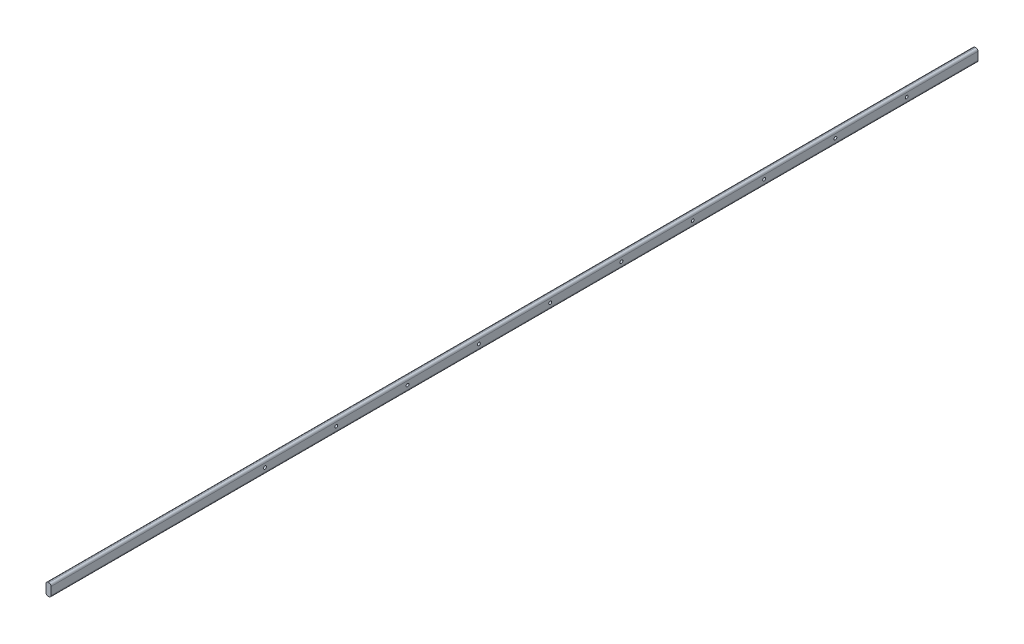
from build123d import *

# Parameters (mm, degrees)
EXTRUDE_1_DEPTH     = 1300
SKETCH_3_R          = 2
CUT_EXTRUDE_1_DEPTH = 1301.046633779


with BuildPart() as part:
    # 草图2 → 凸台-拉伸1 (new body)
    with BuildSketch(Plane.XY):
        with BuildLine():
            Line((-0.5, 8.5), (0.5, 8.5))
            ThreePointArc((0.5, 8.5), (2.621320344, 7.621320344), (3.5, 5.5))
            Line((3.5, 5.5), (3.5, -5.5))
            ThreePointArc((3.5, -5.5), (2.621320344, -7.621320344), (0.5, -8.5))
            Line((0.5, -8.5), (-0.5, -8.5))
            ThreePointArc((-0.5, -8.5), (-2.621320344, -7.621320344), (-3.5, -5.5))
            Line((-3.5, -5.5), (-3.5, 5.5))
            ThreePointArc((-3.5, 5.5), (-2.621320344, 7.621320344), (-0.5, 8.5))
        make_face()
    extrude(amount=EXTRUDE_1_DEPTH)

    # 草图3 → 切除-拉伸1 (cut, through all)
    with BuildSketch(Plane.ZY.offset(3.5)):
        with Locations((100, 0)):
            Circle(SKETCH_3_R)
        with Locations((200, 0)):
            Circle(SKETCH_3_R)
        with Locations((300, 0)):
            Circle(SKETCH_3_R)
        with Locations((400, 0)):
            Circle(SKETCH_3_R)
        with Locations((500, 0)):
            Circle(SKETCH_3_R)
        with Locations((600, 0)):
            Circle(SKETCH_3_R)
        with Locations((700, 0)):
            Circle(SKETCH_3_R)
        with Locations((800, 0)):
            Circle(SKETCH_3_R)
        with Locations((900, 0)):
            Circle(SKETCH_3_R)
        with Locations((1000, 0)):
            Circle(SKETCH_3_R)
    extrude(amount=-CUT_EXTRUDE_1_DEPTH, mode=Mode.SUBTRACT)


solid = part.part
